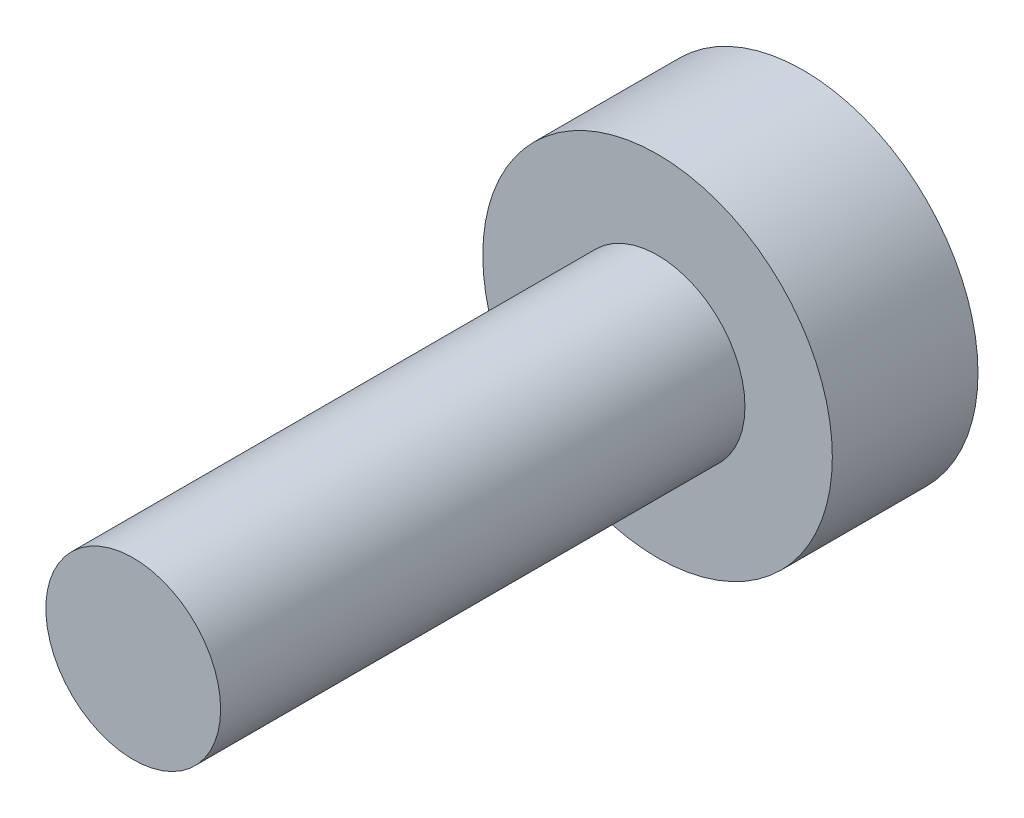
from build123d import *

# Parameters (mm, degrees)
SKETCH_1_R          = 1.5
EXTRUDE_1_DEPTH     = 9
SKETCH_2_R          = 3
EXTRUDE_2_DEPTH     = 2.5
CUT_EXTRUDE_3_DEPTH = 1


with BuildPart() as part:
    # 草图1 → 凸台-拉伸1 (new body)
    with BuildSketch(Plane.XY):
        with Locations((-5.944112119, 3.006217623)):
            Circle(SKETCH_1_R)
    extrude(amount=EXTRUDE_1_DEPTH)

    # 草图2 → 凸台-拉伸2 (add)
    with BuildSketch(Plane(origin=(0, 0, 0), x_dir=(-1, 0, 0), z_dir=(0, 0, -1))):
        with Locations((5.944112119, 3.006217623)):
            Circle(SKETCH_2_R)
    extrude(amount=EXTRUDE_2_DEPTH)

    # 草图4 → 切除-拉伸3 (cut)
    with BuildSketch(Plane(origin=(0, 0, -2.5), x_dir=(-1, 0, 0), z_dir=(0, 0, -1))):
        Polygon((3.944112119, 3.256217623), (5.694112119, 3.256217623), (5.694112119, 5.006217623), (6.194112119, 5.006217623), (6.194112119, 3.256217623), (7.944112119, 3.256217623), (7.944112119, 2.756217623), (6.194112119, 2.756217623), (6.194112119, 1.006217623), (5.694112119, 1.006217623), (5.694112119, 2.756217623), (3.944112119, 2.756217623), align=None)
    extrude(amount=-CUT_EXTRUDE_3_DEPTH, mode=Mode.SUBTRACT)


solid = part.part
